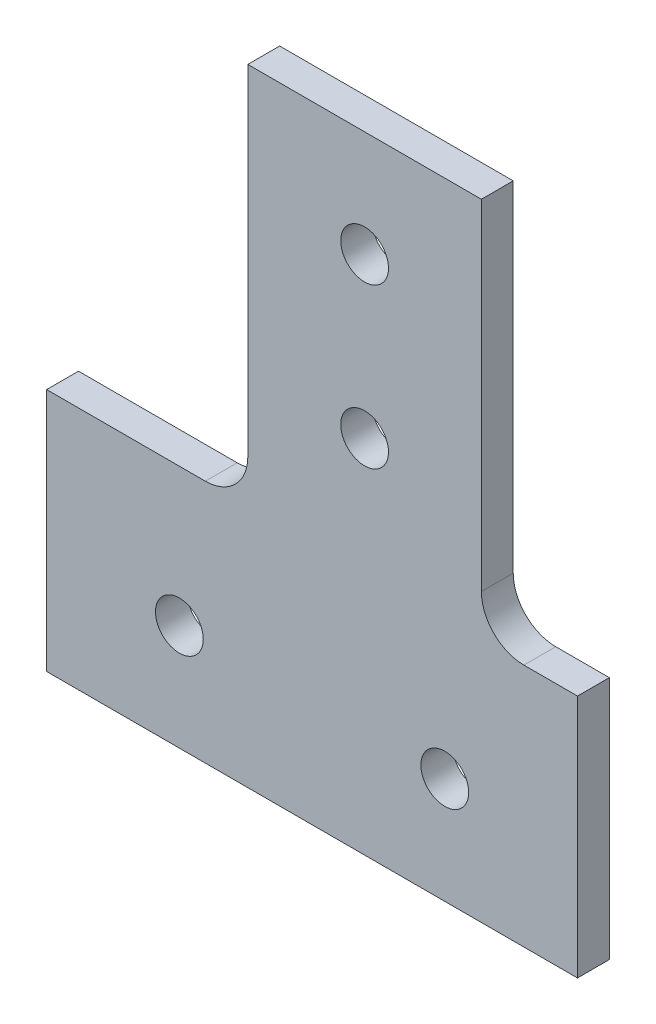
from build123d import *

# Parameters (mm, degrees)
AUFSATZ_LINEAR_AUSTRAGEN1_DEPTH = 3
DURCHGANGSLOCH_F_R_M41_D        = 4.5
DURCHGANGSLOCH_F_R_M42_D        = 4.5
SKIZZE6_W                       = 22
SKIZZE6_H                       = 24
SCHNITT_LINEAR_AUSTRAGEN1_DEPTH = 76.80402364


with BuildPart() as part:
    # Skizze1 → Aufsatz-Linear austragen1 (new body)
    with BuildSketch(Plane.XY):
        with BuildLine():
            Line((-10.0526089, 11.5), (-25, 11.5))
            Line((-25, 11.5), (-25, -11.5))
            Line((-25, -11.5), (25, -11.5))
            Line((25, -11.5), (25, 11.5))
            Line((25, 11.5), (19.9473911, 11.5))
            ThreePointArc((19.9473911, 11.5), (17.118963975, 12.671572875), (15.9473911, 15.5))
            Line((15.9473911, 15.5), (15.9473911, 71.5))
            Line((15.9473911, 71.5), (-6.0526089, 71.5))
            Line((-6.0526089, 71.5), (-6.0526089, 15.5))
            ThreePointArc((-6.0526089, 15.5), (-7.224181775, 12.671572875), (-10.0526089, 11.5))
        make_face()
    extrude(amount=AUFSATZ_LINEAR_AUSTRAGEN1_DEPTH)

    # Durchgangsloch für M41 (through all)
    with Locations(Plane.XY.offset(3)):
        with Locations((4.9473911, 22.5), (4.9473911, 37.5)):
            Hole(DURCHGANGSLOCH_F_R_M41_D / 2)

    # Durchgangsloch für M42 (through all)
    with Locations(Plane.XY.offset(3)):
        with Locations((-12.5, -1.5), (12.5, -1.5)):
            Hole(DURCHGANGSLOCH_F_R_M42_D / 2)

    # Skizze6 → Schnitt-Linear austragen1 (cut, through all)
    with BuildSketch(Plane.XY.offset(3)):
        with Locations((4.9473911, 59.5)):
            Rectangle(SKIZZE6_W, SKIZZE6_H)
    extrude(amount=-SCHNITT_LINEAR_AUSTRAGEN1_DEPTH, mode=Mode.SUBTRACT)


solid = part.part
